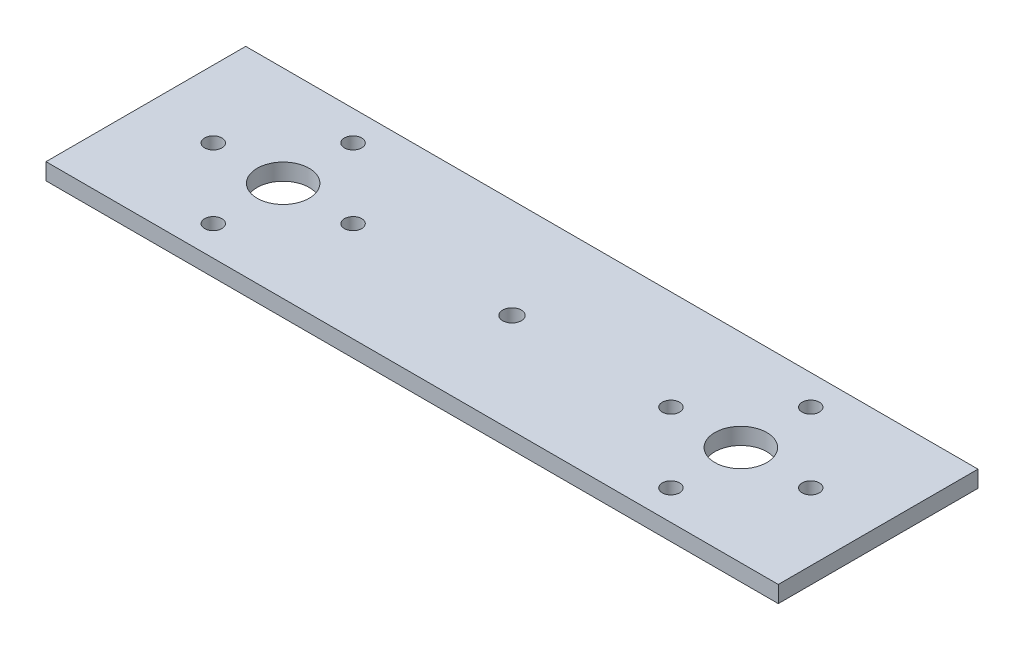
from build123d import *

# Parameters (mm, degrees)
SKETCH1_W                        = 279.4
SKETCH1_H                        = 76.2
BOSS_EXTRUDE1_DEPTH              = 6.35
F_25_32_0_78125_DIAMETER_HOLE1_D = 19.84375
SKETCH6_R                        = 3.302
CUT_EXTRUDE1_DEPTH               = 6.35
CIRPATTERN1_COUNT                = 4
MIRROR2_COPY_1_SKETCH_R          = 3.302
MIRROR2_COPY_1_DEPTH             = 6.35
MIRROR2_COPY_2_SKETCH_R          = 3.302
MIRROR2_COPY_2_DEPTH             = 6.35
MIRROR2_COPY_3_SKETCH_R          = 3.302
MIRROR2_COPY_3_DEPTH             = 6.35
SKETCH7_R                        = 3.556
CUT_EXTRUDE2_DEPTH               = 6.35


with BuildPart() as part:
    # Sketch1 → Boss-Extrude1 (new body)
    with BuildSketch(Plane(origin=(0, 0, 0), x_dir=(1, 0, 0), z_dir=(0, 1, 0))):
        Rectangle(SKETCH1_W, SKETCH1_H)
    extrude(amount=BOSS_EXTRUDE1_DEPTH)

    # 25/32 (0.78125) Diameter Hole1 (through all)
    with Locations(Plane(origin=(0, 6.35, 0), x_dir=(1, 0, 0), z_dir=(0, 1, 0))):
        with Locations((87.3125, 0)):
            f_25_32_0_78125_diameter_hole1 = Hole(F_25_32_0_78125_DIAMETER_HOLE1_D / 2)

    # Sketch6 → Cut-Extrude1 (cut)
    with BuildSketch(Plane(origin=(0, 6.35, 0), x_dir=(1, 0, 0), z_dir=(0, 1, 0))):
        with Locations(Location((60.6425, 0, 0), (0, 0, 270))):
            Circle(SKETCH6_R)
    cut_extrude1 = extrude(amount=-CUT_EXTRUDE1_DEPTH, mode=Mode.SUBTRACT)

    # CirPattern1: Cut-Extrude1 ×4 about axis
    cirpattern1_axis = Axis((87.3125, 0, 0), (0, 1, 0))
    for i in range(1, CIRPATTERN1_COUNT):
        add(cut_extrude1.rotate(cirpattern1_axis, i * 360 / CIRPATTERN1_COUNT), mode=Mode.SUBTRACT)

    # Mirror2: 25/32 (0.78125) Diameter Hole1, Cut-Extrude1 across plane
    add(f_25_32_0_78125_diameter_hole1.mirror(Plane(origin=(0, 0, 0), x_dir=(0, 0, 1), z_dir=(1, 0, 0))), mode=Mode.SUBTRACT)
    add(cut_extrude1.mirror(Plane(origin=(0, 0, 0), x_dir=(0, 0, 1), z_dir=(1, 0, 0))), mode=Mode.SUBTRACT)

    # Mirror2 copy 1 sketch → Mirror2 copy 1 (cut)
    with BuildSketch(Plane(origin=(-87.3125, 6.35, 87.3125), x_dir=(0, 0, -1), z_dir=(0, 1, 0))):
        with Locations((60.6425, 0)):
            Circle(MIRROR2_COPY_1_SKETCH_R)
    extrude(amount=-MIRROR2_COPY_1_DEPTH, mode=Mode.SUBTRACT)

    # Mirror2 copy 2 sketch → Mirror2 copy 2 (cut)
    with BuildSketch(Plane(origin=(-174.625, 6.35, 0), x_dir=(1, 0, 0), z_dir=(0, 1, 0))):
        with Locations((60.6425, 0)):
            Circle(MIRROR2_COPY_2_SKETCH_R)
    extrude(amount=-MIRROR2_COPY_2_DEPTH, mode=Mode.SUBTRACT)

    # Mirror2 copy 3 sketch → Mirror2 copy 3 (cut)
    with BuildSketch(Plane(origin=(-87.3125, 6.35, -87.3125), x_dir=(0, 0, 1), z_dir=(0, 1, 0))):
        with Locations((60.6425, 0)):
            Circle(MIRROR2_COPY_3_SKETCH_R)
    extrude(amount=-MIRROR2_COPY_3_DEPTH, mode=Mode.SUBTRACT)

    # Sketch7 → Cut-Extrude2 (cut)
    with BuildSketch(Plane(origin=(0, 0, 0), x_dir=(-1, 0, 0), z_dir=(0, -1, 0))):
        with Locations(Location((0, 0, 0), (0, 0, 90))):
            Circle(SKETCH7_R)
    extrude(amount=-CUT_EXTRUDE2_DEPTH, mode=Mode.SUBTRACT)


solid = part.part
